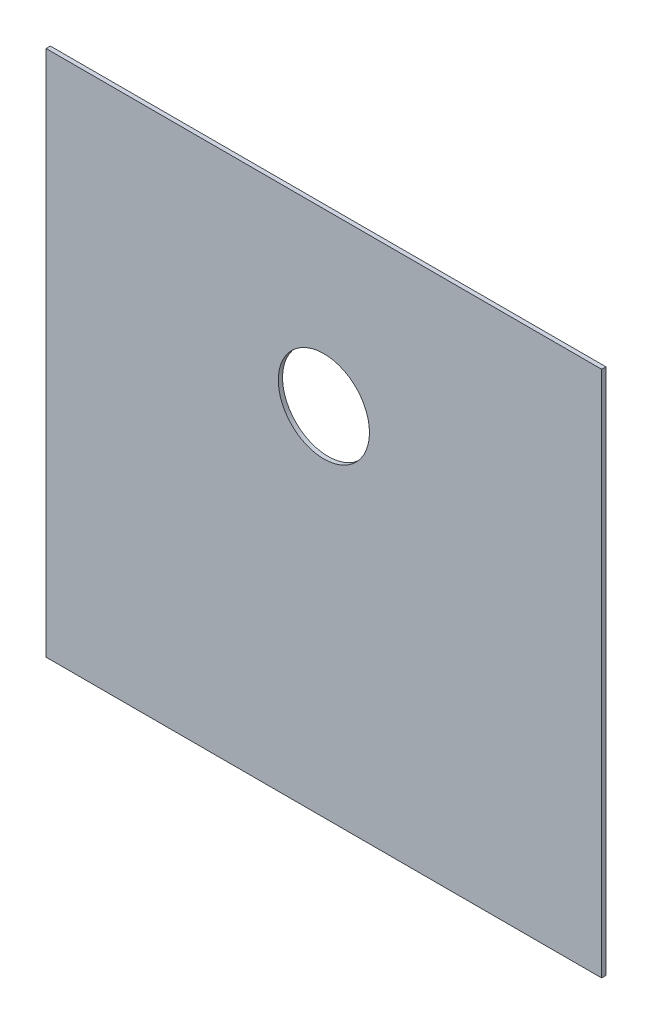
from build123d import *

# Parameters (mm, degrees)
SKETCH1_W           = 390
SKETCH1_H           = 370
BOSS_EXTRUDE1_DEPTH = 3
SKETCH2_R           = 32
CUT_EXTRUDE1_DEPTH  = 269.810342063


with BuildPart() as part:
    # Sketch1 → Boss-Extrude1 (new body)
    with BuildSketch(Plane.XY):
        Rectangle(SKETCH1_W, SKETCH1_H)
    extrude(amount=BOSS_EXTRUDE1_DEPTH)

    # Sketch2 → Cut-Extrude1 (cut, through all)
    with BuildSketch(Plane.XY.offset(3)):
        with Locations((0, 65)):
            Circle(SKETCH2_R)
    extrude(amount=-CUT_EXTRUDE1_DEPTH, mode=Mode.SUBTRACT)


solid = part.part
